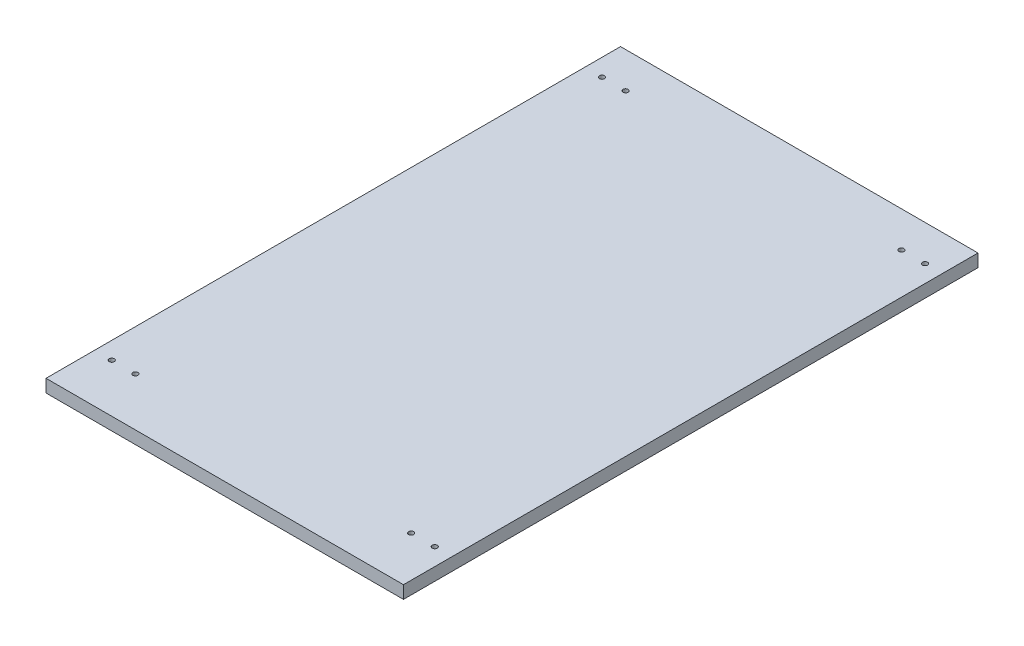
from build123d import *

# Parameters (mm, degrees)
SCHIZZO1_W                   = 280
SCHIZZO1_H                   = 450
ESTRUSIONE_ESTRUSIONE1_DEPTH = 10
SCHIZZO2_R                   = 2
TAGLIO_ESTRUSIONE1_DEPTH     = 10


with BuildPart() as part:
    # Schizzo1 → Estrusione-Estrusione1 (new body)
    with BuildSketch(Plane(origin=(0, 0, 0), x_dir=(1, 0, 0), z_dir=(0, 1, 0))):
        with Locations((-140, 225)):
            Rectangle(SCHIZZO1_W, SCHIZZO1_H)
    extrude(amount=ESTRUSIONE_ESTRUSIONE1_DEPTH)

    # Schizzo2 → Taglio-Estrusione1 (cut)
    with BuildSketch(Plane(origin=(0, 10, 0), x_dir=(1, 0, 0), z_dir=(0, 1, 0))):
        with Locations(Location((-266.5, 38, 0), (0, 0, 270))):
            Circle(SCHIZZO2_R)
        with Locations(Location((-248, 38, 0), (0, 0, 270))):
            Circle(SCHIZZO2_R)
        with Locations(Location((-32, 38, 0), (0, 0, 270))):
            Circle(SCHIZZO2_R)
        with Locations(Location((-13.5, 38, 0), (0, 0, 270))):
            Circle(SCHIZZO2_R)
        with Locations(Location((-13.5, 422, 0), (0, 0, 270))):
            Circle(SCHIZZO2_R)
        with Locations(Location((-32, 422, 0), (0, 0, 270))):
            Circle(SCHIZZO2_R)
        with Locations(Location((-266.5, 422, 0), (0, 0, 270))):
            Circle(SCHIZZO2_R)
        with Locations(Location((-248, 422, 0), (0, 0, 270))):
            Circle(SCHIZZO2_R)
    extrude(amount=-TAGLIO_ESTRUSIONE1_DEPTH, mode=Mode.SUBTRACT)


solid = part.part
